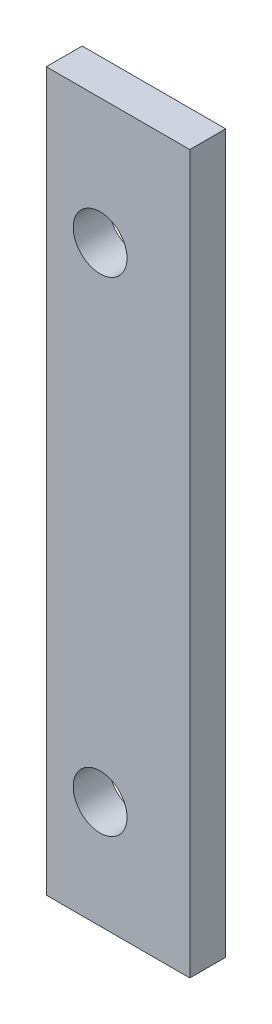
from build123d import *

# Parameters (mm, degrees)
SKETCH1_W           = 8
SKETCH1_H           = 40
BOSS_EXTRUDE1_DEPTH = 2
SKETCH2_R           = 1.5
CUT_EXTRUDE1_DEPTH  = 2


with BuildPart() as part:
    # Sketch1 → Boss-Extrude1 (new body)
    with BuildSketch(Plane.XY):
        Rectangle(SKETCH1_W, SKETCH1_H)
    extrude(amount=BOSS_EXTRUDE1_DEPTH)

    # Sketch2 → Cut-Extrude1 (cut)
    with BuildSketch(Plane.XY.offset(2)):
        with Locations((-1, -14)):
            Circle(SKETCH2_R)
        with Locations((-1, 13)):
            Circle(SKETCH2_R)
    extrude(amount=-CUT_EXTRUDE1_DEPTH, mode=Mode.SUBTRACT)


solid = part.part
